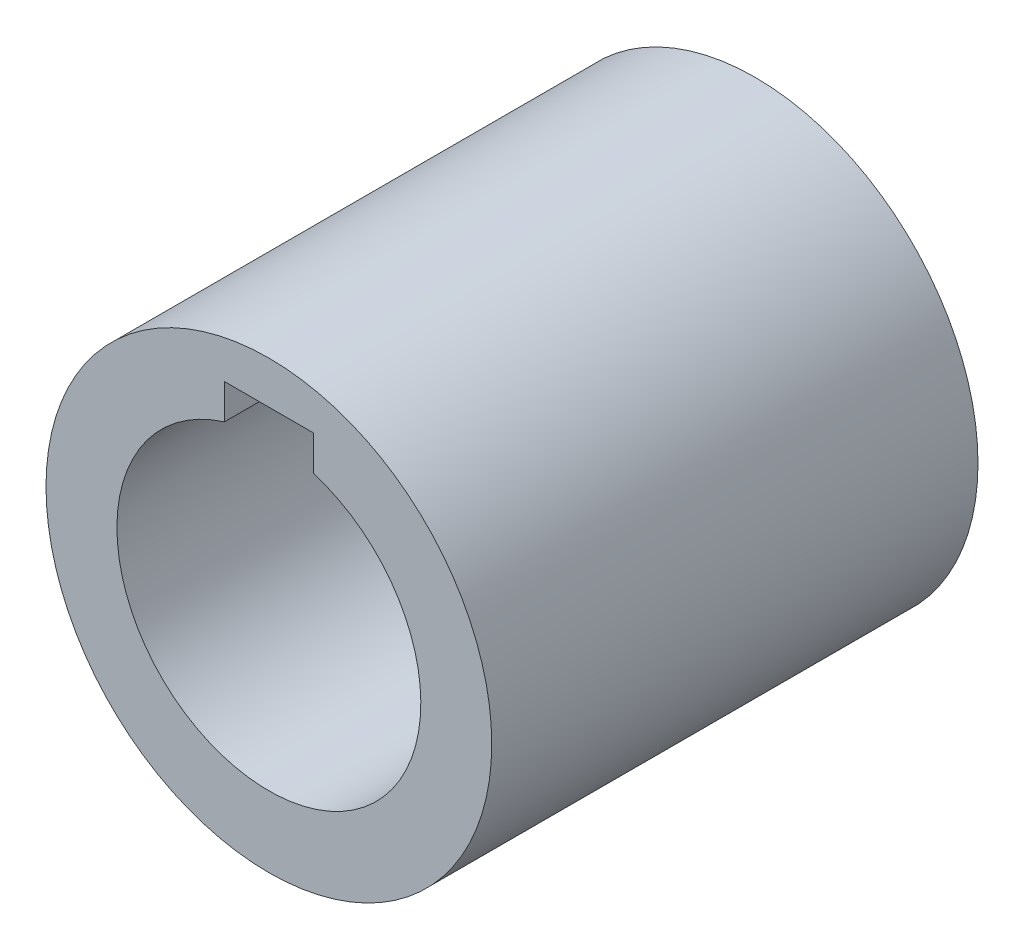
from build123d import *

# Parameters (mm, degrees)
SKETCH1_R               = 55
SKETCH1_R_2             = 37.5
BOSS_EXTRUDE1_DEPTH     = 120
CUT_EXTRUDE1_DEPTH      = 144.003496461
CUT_EXTRUDE1_DEPTH_BACK = 144.003496461
SKETCH2_W               = 22
SKETCH2_H               = 14


with BuildPart() as part:
    # Sketch1 → Boss-Extrude1 (new body)
    with BuildSketch(Plane.XY):
        Circle(SKETCH1_R)
        Circle(SKETCH1_R_2, mode=Mode.SUBTRACT)
    extrude(amount=BOSS_EXTRUDE1_DEPTH)

    # Sketch2 → Cut-Extrude1 (cut, two sides: drawn at the far end of the back side and taken through both)
    with BuildSketch(Plane.XY.offset(120).offset(-CUT_EXTRUDE1_DEPTH_BACK)):
        with Locations((0, 37.5)):
            Rectangle(SKETCH2_W, SKETCH2_H)
    extrude(amount=CUT_EXTRUDE1_DEPTH + CUT_EXTRUDE1_DEPTH_BACK, mode=Mode.SUBTRACT)


solid = part.part
